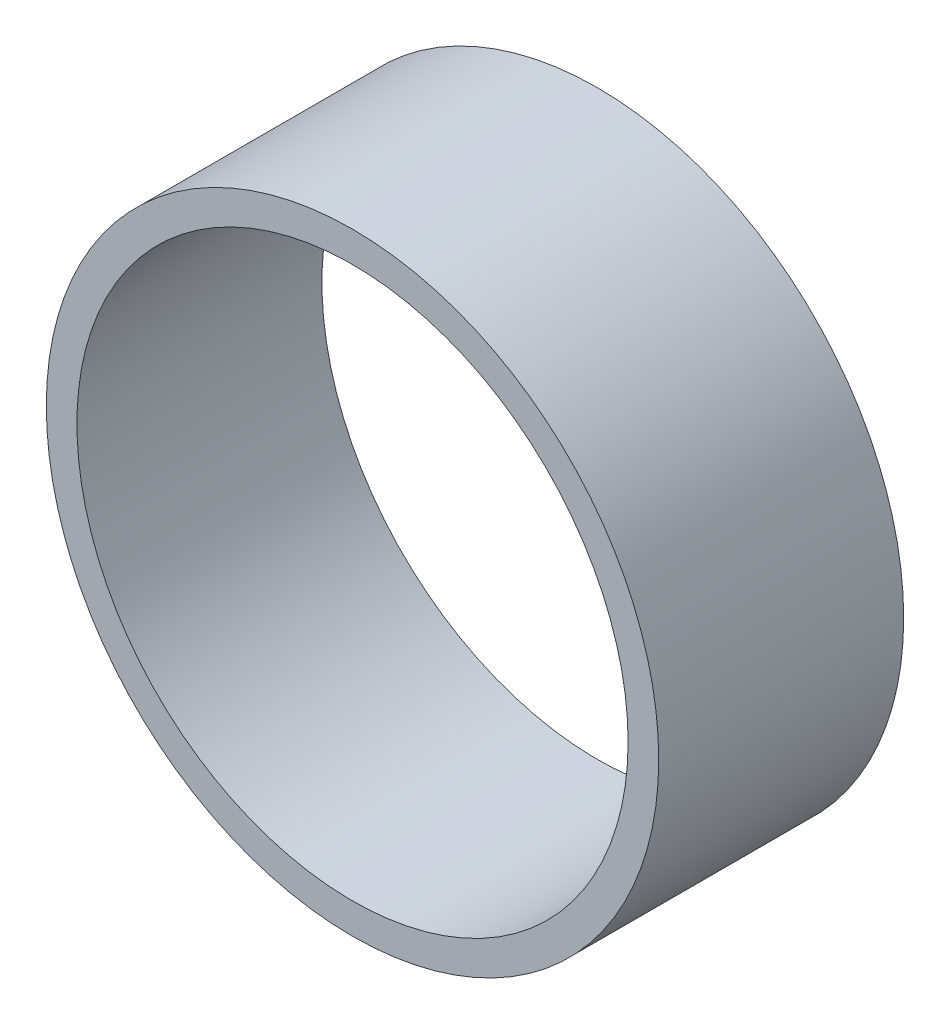
from build123d import *

# Parameters (mm, degrees)
ESQUISSE1_R        = 10
ESQUISSE1_R_2      = 9
BOSS_EXTRU_1_DEPTH = 8


with BuildPart() as part:
    # Esquisse1 → Boss.-Extru.1 (new body)
    with BuildSketch(Plane.XY):
        Circle(ESQUISSE1_R)
        Circle(ESQUISSE1_R_2, mode=Mode.SUBTRACT)
    extrude(amount=BOSS_EXTRU_1_DEPTH)


solid = part.part
